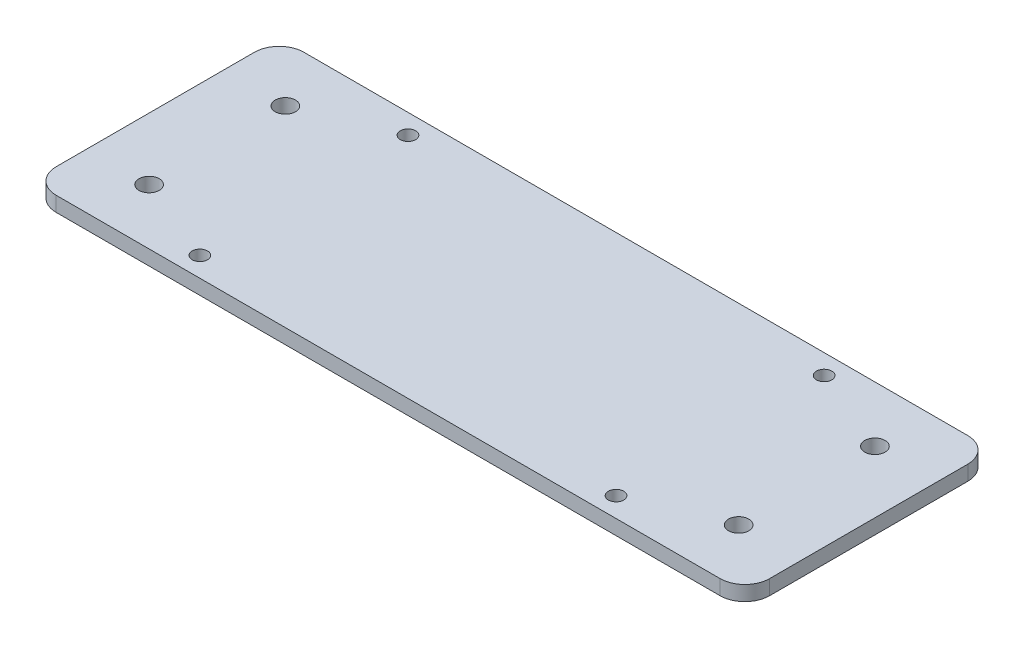
from build123d import *

# Parameters (mm, degrees)
SKETCH1_W           = 144
SKETCH1_H           = 50
SKETCH1_R           = 2.05
SKETCH1_R_2         = 1.55
BOSS_EXTRUDE1_DEPTH = 3
FILLET1_R           = 5


with BuildPart() as part:
    # Sketch1 → Boss-Extrude1 (new body)
    with BuildSketch(Plane(origin=(0, 0, 0), x_dir=(1, 0, 0), z_dir=(0, 1, 0))):
        Rectangle(SKETCH1_W, SKETCH1_H)
        with Locations(Location((59.5, 13.75, 0), (0, 0, 270))):
            Circle(SKETCH1_R, mode=Mode.SUBTRACT)
        with Locations(Location((42, 21, 0), (0, 0, 270))):
            Circle(SKETCH1_R_2, mode=Mode.SUBTRACT)
        with Locations(Location((-42, 21, 0), (0, 0, 90))):
            Circle(SKETCH1_R_2, mode=Mode.SUBTRACT)
        with Locations(Location((-59.5, 13.75, 0), (0, 0, 90))):
            Circle(SKETCH1_R, mode=Mode.SUBTRACT)
        with Locations(Location((-59.5, -13.75, 0), (0, 0, 270))):
            Circle(SKETCH1_R, mode=Mode.SUBTRACT)
        with Locations(Location((-42, -21, 0), (0, 0, 270))):
            Circle(SKETCH1_R_2, mode=Mode.SUBTRACT)
        with Locations(Location((42, -21, 0), (0, 0, 90))):
            Circle(SKETCH1_R_2, mode=Mode.SUBTRACT)
        with Locations(Location((59.5, -13.75, 0), (0, 0, 90))):
            Circle(SKETCH1_R, mode=Mode.SUBTRACT)
    extrude(amount=BOSS_EXTRUDE1_DEPTH)

    # Fillet1
    fillet1_edges = [part.edges().sort_by_distance(p)[0] for p in [
        (72, 1.5, 25),
        (-72, 1.5, 25),
        (-72, 1.5, -25),
        (72, 1.5, -25),
    ]]
    fillet(fillet1_edges, radius=FILLET1_R)


solid = part.part
